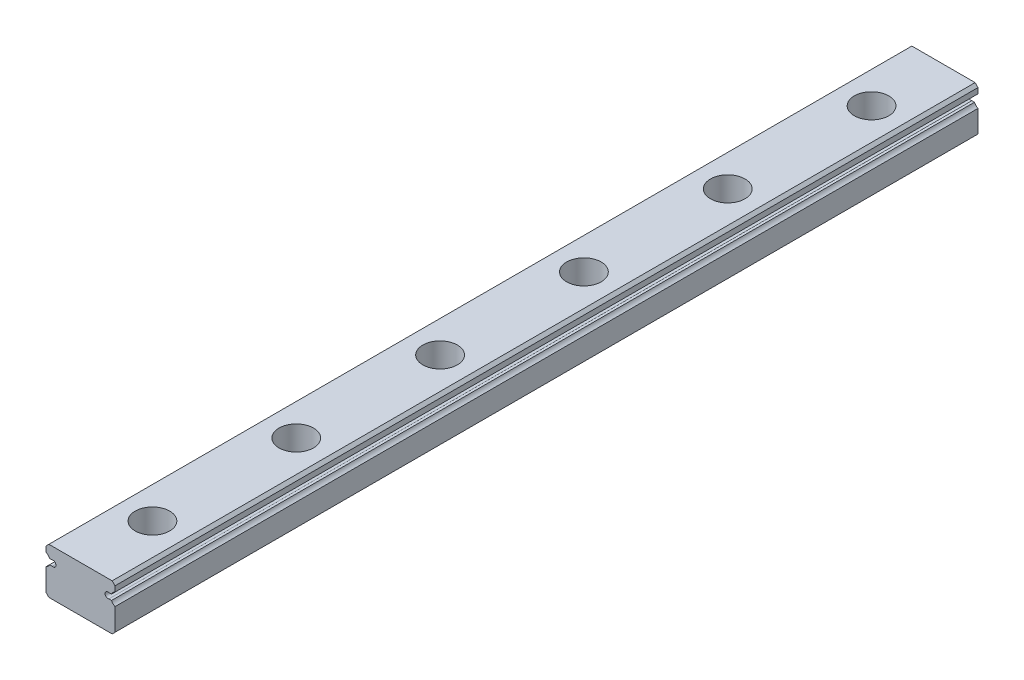
from build123d import *

# Parameters (mm, degrees)
BOSS_EXTRUDE1_DEPTH = 150
SKETCH2_R           = 3
CUT_EXTRUDE1_DEPTH  = 4.5
SKETCH3_R           = 1.75
CUT_EXTRUDE2_DEPTH  = 151.187382959
LPATTERN1_COUNT     = 6
LPATTERN1_PITCH     = 25


with BuildPart() as part:
    # Sketch1 → Boss-Extrude1 (new body)
    with BuildSketch(Plane.XY):
        with BuildLine():
            Line((6, -3.5), (6, 0.368911094))
            ThreePointArc((6, 0.368911094), (5.63354293, 0.61854293), (5.383911094, 0.985))
            Line((5.383911094, 0.985), (4.92112495, 0.985))
            ThreePointArc((4.92112495, 0.985), (4.265, 1.46), (4.92112495, 1.935))
            Line((4.92112495, 1.935), (5.383911094, 1.935))
            ThreePointArc((5.383911094, 1.935), (5.63354293, 2.30145707), (6, 2.551088906))
            Line((6, 2.551088906), (6, 3.5))
            Line((6, 3.5), (5.5, 4))
            Line((5.5, 4), (-5.5, 4))
            Line((-5.5, 4), (-6, 3.5))
            Line((-6, 3.5), (-6, 2.551088906))
            ThreePointArc((-6, 2.551088906), (-5.63354293, 2.30145707), (-5.383911094, 1.935))
            Line((-5.383911094, 1.935), (-4.92112495, 1.935))
            ThreePointArc((-4.92112495, 1.935), (-4.265, 1.46), (-4.92112495, 0.985))
            Line((-4.92112495, 0.985), (-5.383911094, 0.985))
            ThreePointArc((-5.383911094, 0.985), (-5.63354293, 0.61854293), (-6, 0.368911094))
            Line((-6, 0.368911094), (-6, -3.5))
            Line((-6, -3.5), (-5.5, -4))
            Line((-5.5, -4), (5.5, -4))
            Line((5.5, -4), (6, -3.5))
        make_face()
    extrude(amount=BOSS_EXTRUDE1_DEPTH)

    # Sketch2 → Cut-Extrude1 (cut)
    with BuildSketch(Plane(origin=(0, 4, 0), x_dir=(1, 0, 0), z_dir=(0, 1, 0))):
        with Locations(Location((0, -12.5, 0), (0, 0, 180))):
            Circle(SKETCH2_R)
    cut_extrude1 = extrude(amount=-CUT_EXTRUDE1_DEPTH, mode=Mode.SUBTRACT)

    # Sketch3 → Cut-Extrude2 (cut, through all)
    with BuildSketch(Plane(origin=(0, -0.5, 0), x_dir=(1, 0, 0), z_dir=(0, 1, 0))):
        with Locations(Location((0, -12.5, 0), (0, 0, 180))):
            Circle(SKETCH3_R)
    cut_extrude2 = extrude(amount=-CUT_EXTRUDE2_DEPTH, mode=Mode.SUBTRACT)

    # LPattern1: Cut-Extrude1, Cut-Extrude2 ×6
    with Locations(*[(0, 0, i * LPATTERN1_PITCH) for i in range(1, LPATTERN1_COUNT)]):
        add(cut_extrude1, mode=Mode.SUBTRACT)
        add(cut_extrude2, mode=Mode.SUBTRACT)


solid = part.part
